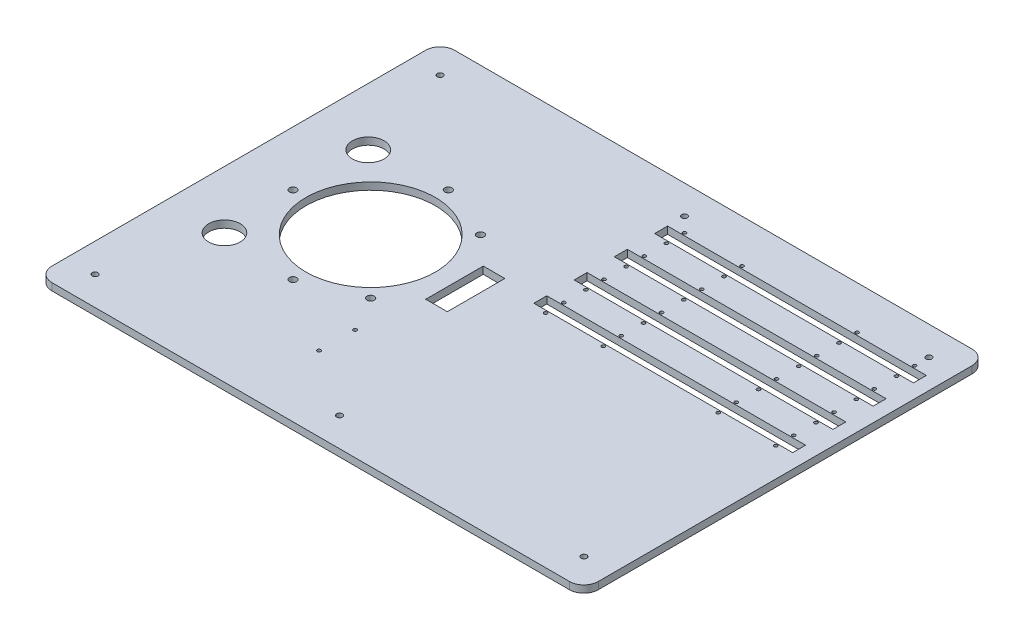
from build123d import *

# Parameters (mm, degrees)
SKETCH1_W           = 482.6
SKETCH1_H           = 355.6
BOSS_EXTRUDE1_DEPTH = 6.35
SKETCH2_R           = 2.55
CUT_EXTRUDE1_DEPTH  = 600.495156361
FILLET1_R           = 12.7
SKETCH5_R           = 1.5
CUT_EXTRUDE4_DEPTH  = 600.495156361
SKETCH8_W           = 19.05
SKETCH8_H           = 50.8
CUT_EXTRUDE7_DEPTH  = 63.5
CUT_EXTRUDE9_DEPTH  = 6.35
SKETCH12_R          = 14
SKETCH12_W          = 12.7
SKETCH12_H          = 10.884798806
CUT_EXTRUDE11_DEPTH = 63.5
SKETCH13_W          = 220.004592511
SKETCH13_H          = 264.065052174
BOSS_EXTRUDE2_DEPTH = 6.35
SKETCH15_R          = 13.97
CUT_EXTRUDE13_DEPTH = 600.495156361
LPATTERN1_COUNT     = 4
LPATTERN1_PITCH     = 35.56
SKETCH17_W          = 228.6
SKETCH17_H          = 11.43
CUT_EXTRUDE14_DEPTH = 600.495156361
SKETCH18_W          = 19.05
SKETCH18_H          = 50.8
CUT_EXTRUDE15_DEPTH = 600.495156361
SKETCH19_R          = 1.5875
CUT_EXTRUDE16_DEPTH = 600.495156361
SKETCH20_R          = 57.15
CUT_EXTRUDE17_DEPTH = 600.495156361
SKETCH21_R          = 3.175
CUT_EXTRUDE18_DEPTH = 600.495156361


with BuildPart() as part:
    # Sketch1 → Boss-Extrude1 (new body)
    with BuildSketch(Plane(origin=(0, 0, 0), x_dir=(1, 0, 0), z_dir=(0, 1, 0))):
        with Locations((241.3, 177.8)):
            Rectangle(SKETCH1_W, SKETCH1_H)
    extrude(amount=BOSS_EXTRUDE1_DEPTH)

    # Sketch2 → Cut-Extrude1 (cut, through all)
    with BuildSketch(Plane(origin=(0, 6.35, 0), x_dir=(1, 0, 0), z_dir=(0, 1, 0))):
        with Locations(Location((25.4, 330.2, 0), (0, 0, 270))):
            Circle(SKETCH2_R)
        with Locations(Location((241.3, 330.2, 0), (0, 0, 270))):
            Circle(SKETCH2_R)
        with Locations(Location((457.2, 330.2, 0), (0, 0, 270))):
            Circle(SKETCH2_R)
        with Locations(Location((241.3, 25.4, 0), (0, 0, 270))):
            Circle(SKETCH2_R)
        with Locations(Location((457.2, 25.4, 0), (0, 0, 270))):
            Circle(SKETCH2_R)
        with Locations(Location((25.4, 25.4, 0), (0, 0, 270))):
            Circle(SKETCH2_R)
    extrude(amount=-CUT_EXTRUDE1_DEPTH, mode=Mode.SUBTRACT)

    # Fillet1
    fillet1_edges = [part.edges().sort_by_distance(p)[0] for p in [
        (0, 3.175, -355.6),
        (482.6, 3.175, -355.6),
        (482.6, 3.175, 0),
        (0, 3.175, 0),
    ]]
    fillet(fillet1_edges, radius=FILLET1_R)

    # Sketch5 → Cut-Extrude4 (cut, through all)
    with BuildSketch(Plane(origin=(0, 6.35, 0), x_dir=(1, 0, 0), z_dir=(0, 1, 0))):
        with Locations(Location((254, 317.5, 0), (0, 0, 270))):
            Circle(SKETCH5_R)
        with Locations(Location((304.8, 317.5, 0), (0, 0, 270))):
            Circle(SKETCH5_R)
        with Locations(Location((406.4, 317.5, 0), (0, 0, 270))):
            Circle(SKETCH5_R)
        with Locations(Location((457.2, 317.5, 0), (0, 0, 270))):
            Circle(SKETCH5_R)
        with Locations(Location((304.8, 301.498, 0), (0, 0, 270))):
            Circle(SKETCH5_R)
        with Locations(Location((406.4, 301.498, 0), (0, 0, 270))):
            Circle(SKETCH5_R)
        with Locations(Location((457.2, 301.498, 0), (0, 0, 270))):
            Circle(SKETCH5_R)
        with Locations(Location((254, 301.498, 0), (0, 0, 270))):
            Circle(SKETCH5_R)
    cut_extrude4 = extrude(amount=-CUT_EXTRUDE4_DEPTH, mode=Mode.SUBTRACT)

    # Sketch8 → Cut-Extrude7 (cut, symmetric)
    with BuildSketch(Plane(origin=(0, 6.35, 0), x_dir=(1, 0, 0), z_dir=(0, 1, 0))):
        with Locations((200.025, 177.8)):
            Rectangle(SKETCH8_W, SKETCH8_H)
    extrude(amount=CUT_EXTRUDE7_DEPTH, both=True, mode=Mode.SUBTRACT)

    # Sketch10 → Cut-Extrude9 (cut)
    with BuildSketch(Plane(origin=(0, 6.35, 0), x_dir=(1, 0, 0), z_dir=(0, 1, 0))):
        Polygon((109.7915, 301.9425), (20.8788, 301.9425), (20.8788, 297.4467), (25.4, 297.4467), (25.4, 58.1533), (20.8788, 58.1533), (20.8788, 53.6575), (109.7915, 53.6575), (109.7915, 58.1533), (29.8958, 58.1533), (29.8958, 297.4467), (109.7915, 297.4467), align=None)
        Polygon((224.1042, 301.9425), (135.1915, 301.9425), (135.1915, 297.4467), (215.0872, 297.4467), (215.0872, 190.5), (219.583, 190.5), (219.583, 297.4467), (224.1042, 297.4467), align=None)
        Polygon((219.583, 165.1), (215.0872, 165.1), (215.0872, 58.1533), (135.1915, 58.1533), (135.1915, 53.6575), (224.1042, 53.6575), (224.1042, 58.1533), (219.583, 58.1533), align=None)
    extrude(amount=-CUT_EXTRUDE9_DEPTH, mode=Mode.SUBTRACT)

    # Sketch12 → Cut-Extrude11 (cut, symmetric)
    with BuildSketch(Plane(origin=(0, 6.35, 0), x_dir=(1, 0, 0), z_dir=(0, 1, 0))):
        with Locations((50.8, 241.3)):
            Circle(SKETCH12_R)
        with Locations((50.8, 114.3)):
            Circle(SKETCH12_R)
        with Locations((70.04884835, 241.3)):
            Rectangle(SKETCH12_W, SKETCH12_H)
        with Locations((70.04884835, 114.3)):
            Rectangle(SKETCH12_W, SKETCH12_H)
    extrude(amount=CUT_EXTRUDE11_DEPTH, both=True, mode=Mode.SUBTRACT)

    # Sketch13 → Boss-Extrude2 (add)
    with BuildSketch(Plane(origin=(0, 6.35, 0), x_dir=(1, 0, 0), z_dir=(0, 1, 0))):
        with Locations((121.094975677, 181.991146523)):
            Rectangle(SKETCH13_W, SKETCH13_H)
    extrude(amount=-BOSS_EXTRUDE2_DEPTH)

    # Sketch15 → Cut-Extrude13 (cut, through all)
    with BuildSketch(Plane(origin=(0, 6.35, 0), x_dir=(1, 0, 0), z_dir=(0, 1, 0))):
        with Locations(Location((50.8, 241.3, 0), (0, 0, 270))):
            Circle(SKETCH15_R)
        with Locations(Location((50.8, 114.3, 0), (0, 0, 270))):
            Circle(SKETCH15_R)
    extrude(amount=-CUT_EXTRUDE13_DEPTH, mode=Mode.SUBTRACT)

    # LPattern1: Cut-Extrude4 ×4
    with Locations(*[(0, 0, i * LPATTERN1_PITCH) for i in range(1, LPATTERN1_COUNT)]):
        add(cut_extrude4, mode=Mode.SUBTRACT)

    # Sketch17 → Cut-Extrude14 (cut, through all)
    with BuildSketch(Plane(origin=(0, 6.35, 0), x_dir=(1, 0, 0), z_dir=(0, 1, 0))):
        with Locations((355.6, 309.499)):
            Rectangle(SKETCH17_W, SKETCH17_H)
        with Locations((355.6, 273.939)):
            Rectangle(SKETCH17_W, SKETCH17_H)
        with Locations((355.6, 238.379)):
            Rectangle(SKETCH17_W, SKETCH17_H)
        with Locations((355.6, 202.819)):
            Rectangle(SKETCH17_W, SKETCH17_H)
    extrude(amount=-CUT_EXTRUDE14_DEPTH, mode=Mode.SUBTRACT)

    # Sketch18 → Cut-Extrude15 (cut, through all)
    with BuildSketch(Plane(origin=(0, 6.35, 0), x_dir=(1, 0, 0), z_dir=(0, 1, 0))):
        with Locations((200.025, 177.8)):
            Rectangle(SKETCH18_W, SKETCH18_H)
    extrude(amount=-CUT_EXTRUDE15_DEPTH, mode=Mode.SUBTRACT)

    # Sketch19 → Cut-Extrude16 (cut, through all)
    with BuildSketch(Plane(origin=(0, 6.35, 0), x_dir=(1, 0, 0), z_dir=(0, 1, 0))):
        with Locations(Location((182.7, 97.775, 0), (0, 0, 270))):
            Circle(SKETCH19_R)
        with Locations(Location((182.7, 66.025, 0), (0, 0, 270))):
            Circle(SKETCH19_R)
    extrude(amount=-CUT_EXTRUDE16_DEPTH, mode=Mode.SUBTRACT)

    # Sketch20 → Cut-Extrude17 (cut, through all)
    with BuildSketch(Plane(origin=(0, 6.35, 0), x_dir=(1, 0, 0), z_dir=(0, 1, 0))):
        with Locations(Location((116.84, 177.426070104, 0), (0, 0, 270))):
            Circle(SKETCH20_R)
    extrude(amount=-CUT_EXTRUDE17_DEPTH, mode=Mode.SUBTRACT)

    # Sketch21 → Cut-Extrude18 (cut, through all)
    with BuildSketch(Plane(origin=(0, 6.35, 0), x_dir=(1, 0, 0), z_dir=(0, 1, 0))):
        with Locations(Location((116.84, 246.006070104, 0), (0, 0, 270))):
            Circle(SKETCH21_R)
        with Locations(Location((48.26, 177.426070104, 0), (0, 0, 270))):
            Circle(SKETCH21_R)
        with Locations(Location((116.84, 108.846070104, 0), (0, 0, 270))):
            Circle(SKETCH21_R)
        with Locations(Location((165.333383054, 128.93268705, 0), (0, 0, 270))):
            Circle(SKETCH21_R)
        with Locations(Location((165.333383054, 225.919453158, 0), (0, 0, 270))):
            Circle(SKETCH21_R)
    extrude(amount=-CUT_EXTRUDE18_DEPTH, mode=Mode.SUBTRACT)


solid = part.part
